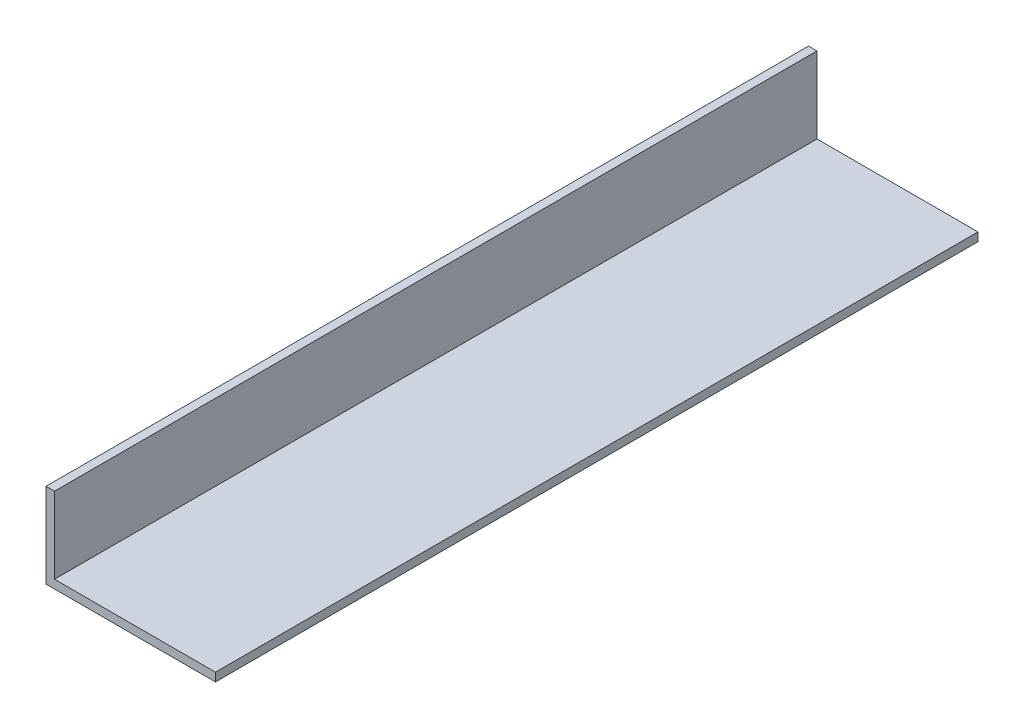
from build123d import *

# Parameters (mm, degrees)
BOSS_EXTRUDE1_DEPTH = 180


with BuildPart() as part:
    # Sketch1 → Boss-Extrude1 (new body)
    with BuildSketch(Plane.XY):
        Polygon((-69.579831933, 29.327731092), (-67.579831933, 29.327731092), (-67.579831933, 11.327731092), (-29.579831933, 11.327731092), (-29.579831933, 9.327731092), (-69.579831933, 9.327731092), (-69.579831933, 11.327731092), align=None)
    extrude(amount=BOSS_EXTRUDE1_DEPTH)


solid = part.part
